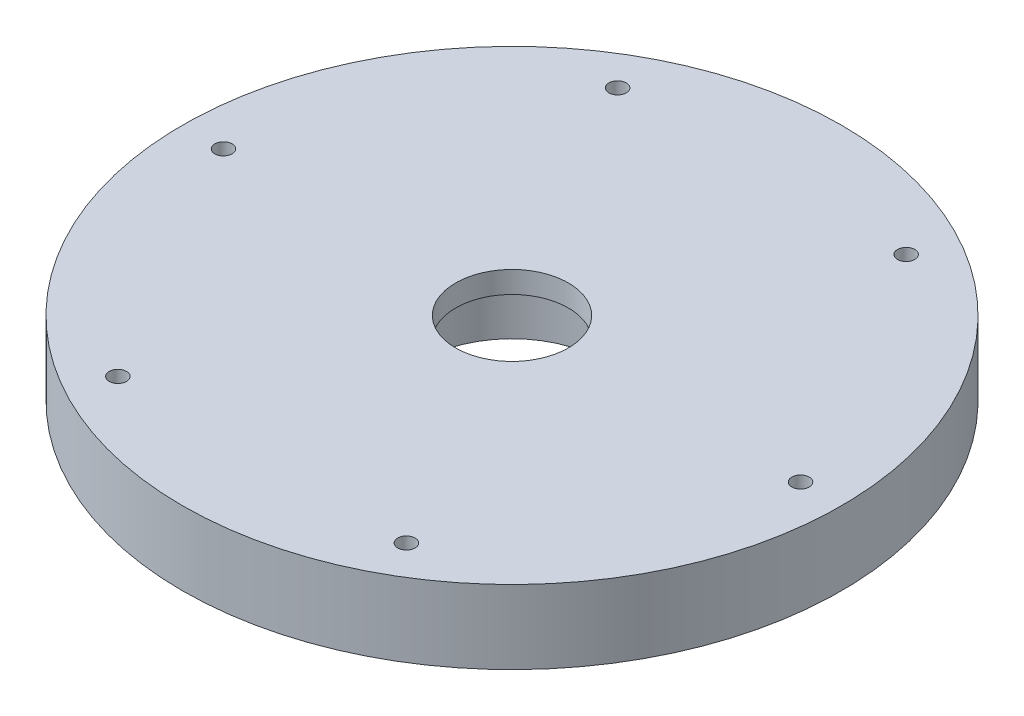
from build123d import *

# Parameters (mm, degrees)
SKETCH2_R          = 1
CUT_EXTRUDE1_DEPTH = 55.617419382


with BuildPart() as part:
    # Sketch1 → Revolve1 (revolve)
    with BuildSketch(Plane.XY, mode=Mode.PRIVATE) as revolve1_sk:
        Polygon((-6.5, 0), (-38, 0), (-38, -8.5), (-35, -8.5), (-35, -9.75), (-10.5, -9.75), (-10.5, -2.5), (-6.5, -2.5), align=None)
    revolve(revolve1_sk.sketch.rotate(Axis((0, 38.708668819, 0), (0, -1, 0)), 270), axis=Axis((0, 38.708668819, 0), (0, -1, 0)))

    # Sketch2 → Cut-Extrude1 (cut, through all)
    with BuildSketch(Plane.XZ.offset(9.75)):
        with Locations(Location((-33.26875, 0, 0), (0, 0, 270))):
            Circle(SKETCH2_R)
        with Locations(Location((-16.634375, 28.811582652, 0), (0, 0, 270))):
            Circle(SKETCH2_R)
        with Locations(Location((16.634375, 28.811582652, 0), (0, 0, 270))):
            Circle(SKETCH2_R)
        with Locations(Location((33.26875, 0, 0), (0, 0, 270))):
            Circle(SKETCH2_R)
        with Locations(Location((16.634375, -28.811582652, 0), (0, 0, 270))):
            Circle(SKETCH2_R)
        with Locations(Location((-16.634375, -28.811582652, 0), (0, 0, 270))):
            Circle(SKETCH2_R)
    extrude(amount=-CUT_EXTRUDE1_DEPTH, mode=Mode.SUBTRACT)


solid = part.part
